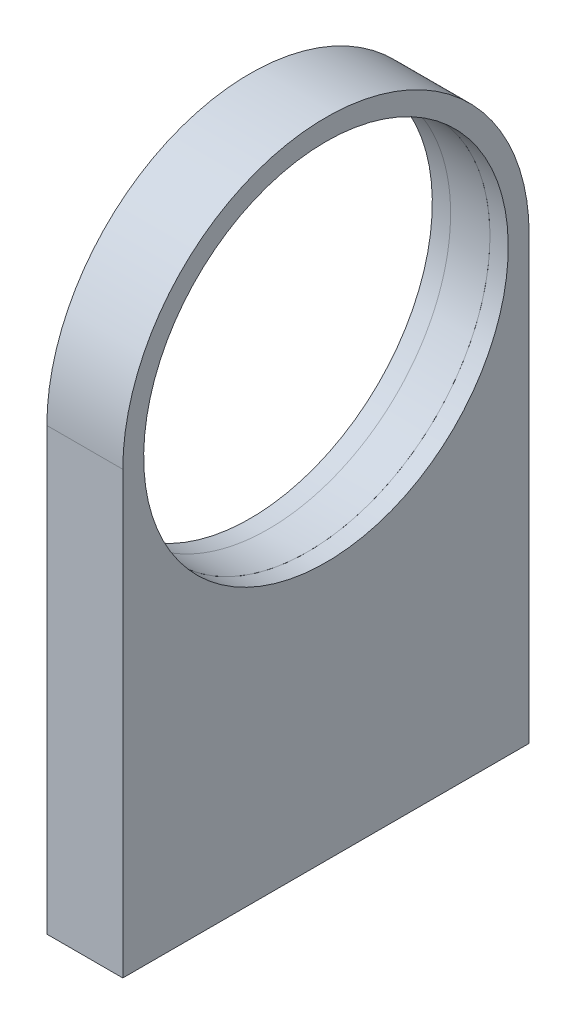
from build123d import *

# Parameters (mm, degrees)
DODANIE_WYCI_GNI_CIE1_START = -40
DODANIE_WYCI_GNI_CIE1_DEPTH = 40
SZKIC4_R                    = 96
WYTNIJ_WYCI_GNI_CIE1_DEPTH  = 40


with BuildPart() as part:
    # Szkic1 → Obrót1 (revolve)
    with BuildSketch(Plane.XY):
        Polygon((-52.739893705, 77.020736352), (-92.739893705, 77.020736352), (-92.739893705, 88.020736352), (-83.110941126, 88.020736352), (-83.110941126, 96.020736352), (-92.739893705, 96.020736352), (-92.739893705, 107.020736352), (-52.739893705, 107.020736352), (-52.739893705, 96.020736352), (-62.368846284, 96.020736352), (-62.368846284, 88.020736352), (-52.739893705, 88.020736352), align=None)
    revolve(axis=Axis((0, 0, 0), (-1, 0, 0)))

    # Szkic2 → Dodanie-wyciągnięcie1 (add)
    with BuildSketch(Plane.ZY.offset(92.739893705).offset(DODANIE_WYCI_GNI_CIE1_START)):
        with BuildLine():
            ThreePointArc((-107.020736352, 0), (0, -107.020736352), (107.020736352, 0))
            Line((107.020736352, 0), (107.020736352, -232.057883899))
            Line((107.020736352, -232.057883899), (-107.020736352, -232.057883899))
            Line((-107.020736352, -232.057883899), (-107.020736352, 0))
        make_face()
    extrude(amount=DODANIE_WYCI_GNI_CIE1_DEPTH)

    # Szkic4 → Wytnij-wyciągnięcie1 (cut)
    with BuildSketch(Plane.ZY.offset(92.739893705)):
        with Locations(Location((0, 0, 0), (0, 0, 270))):
            Circle(SZKIC4_R)
    extrude(amount=-WYTNIJ_WYCI_GNI_CIE1_DEPTH, mode=Mode.SUBTRACT)


solid = part.part
